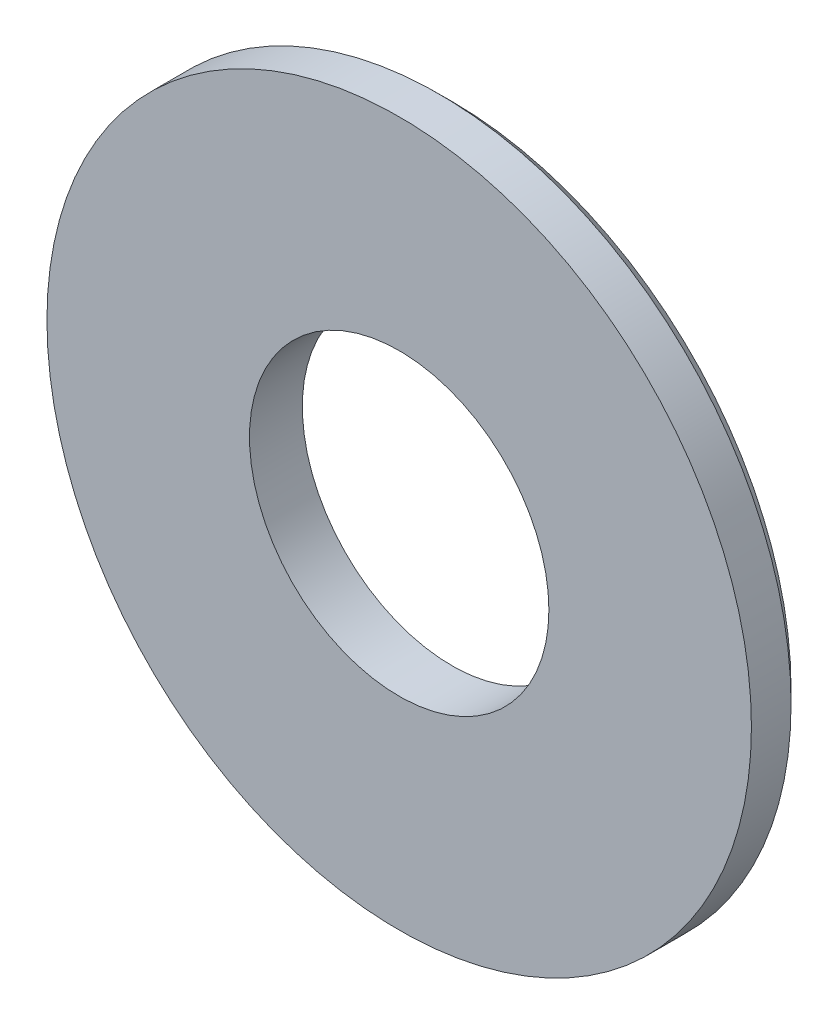
from build123d import *

# Parameters (mm, degrees)
SKICA1_R        = 2
SKICA1_R_2      = 0.85
VYSUNOUT1_DEPTH = 0.3
ZKOSIT1_SIZE    = 0.075


with BuildPart() as part:
    # Skica1 → Vysunout1 (new body)
    with BuildSketch(Plane.XY):
        Circle(SKICA1_R)
        Circle(SKICA1_R_2, mode=Mode.SUBTRACT)
    extrude(amount=VYSUNOUT1_DEPTH)

    # Zkosit1
    zkosit1_edges = [part.edges().sort_by_distance(p)[0] for p in [
        (-2, 0, 0),
    ]]
    chamfer(zkosit1_edges, length=ZKOSIT1_SIZE)


solid = part.part
